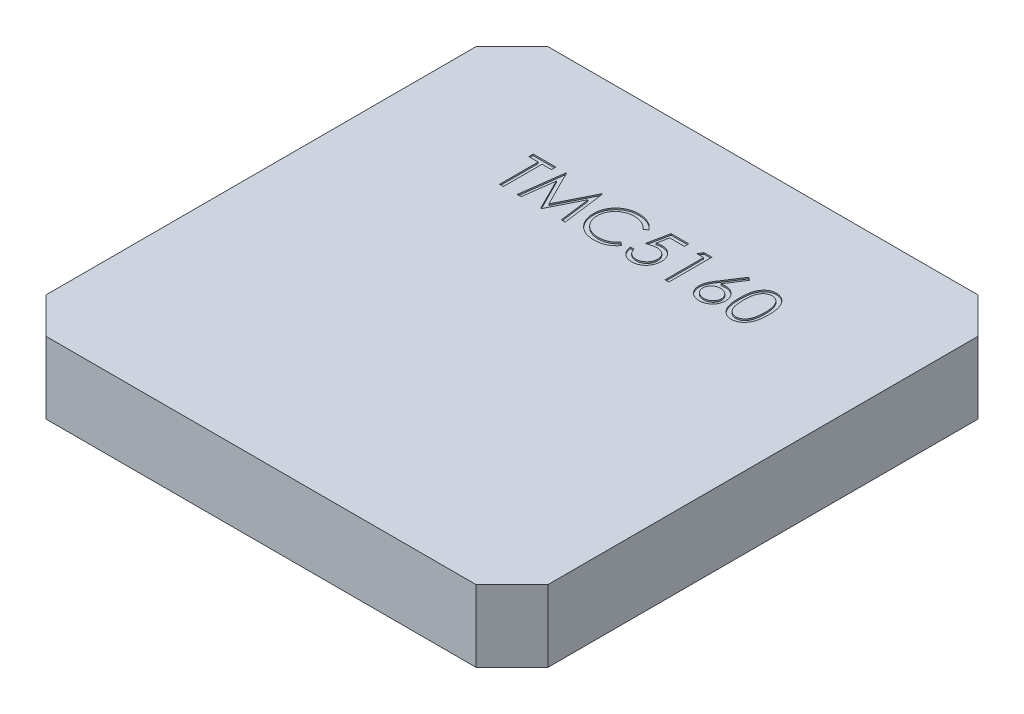
from build123d import *

# Parameters (mm, degrees)
BASES_W          = 7
BASES_H          = 7
BASE_DEPTH       = 1
PARTNUMBER_DEPTH = 0.02
PNC_SIZE         = 0.5


with BuildPart() as part:
    # BaseS → Base (new body)
    with BuildSketch(Plane(origin=(0, 0, 0), x_dir=(1, 0, 0), z_dir=(0, 1, 0))):
        Rectangle(BASES_W, BASES_H)
    extrude(amount=BASE_DEPTH)

    # PartNumberS → PartNumber (cut)
    # profile 1 of 7: a face of its own
    with BuildSketch(Plane(origin=(0, 1, 0), x_dir=(1, 0, 0), z_dir=(0, 1, 0))):
        with BuildLine():
            add(Edge.make_bspline(
                [(1.373076923, 1.799759615), (1.373133155, 1.80937631), (1.373242386, 1.828056879), (1.374457543, 1.855277104), (1.376476174, 1.880813153), (1.37924258, 1.90466625), (1.382609091, 1.926842553), (1.387103175, 1.947282797), (1.392213941, 1.966081586), (1.398137217, 1.983300223), (1.404820838, 1.999170687), (1.412095283, 2.013986435), (1.420249248, 2.027725052), (1.428816718, 2.040605816), (1.438144502, 2.052417878), (1.447967152, 2.063328049), (1.458668045, 2.073084178), (1.469883418, 2.081972115), (1.481714812, 2.089763453), (1.493824983, 2.096626209), (1.506297287, 2.102489043), (1.519165776, 2.107098832), (1.532314785, 2.110906406), (1.545790283, 2.113510225), (1.559614516, 2.115148552), (1.56894562, 2.115305181), (1.573677885, 2.115384615)],
                knots=[0, 0, 0, 0, 1.646270934, 3.197905019, 4.663502075, 6.030701355, 7.308322542, 8.50163776, 9.611534131, 10.641858119, 11.616356847, 12.558055219, 13.465016945, 14.349605745, 15.204443733, 16.039544428, 16.859896111, 17.680448484, 18.487036065, 19.28249412, 20.06191084, 20.843045899, 21.620316918, 22.403196591, 23.190181807, 24, 24, 24, 24], degree=3))
            add(Edge.make_bspline(
                [(1.573677885, 2.115384615), (1.578449681, 2.11530099), (1.587939282, 2.115134685), (1.601969061, 2.113536295), (1.615674721, 2.110884103), (1.62899783, 2.107126221), (1.642047828, 2.102464105), (1.654722641, 2.096620599), (1.667100998, 2.089818508), (1.67898619, 2.081825843), (1.690508695, 2.072914596), (1.701385489, 2.062840995), (1.711617561, 2.051706758), (1.721333327, 2.03963101), (1.730257144, 2.026382138), (1.738755447, 2.012190576), (1.746362081, 1.996808142), (1.753688026, 1.980491491), (1.760011509, 1.962789149), (1.765714294, 1.943800905), (1.770322117, 1.923302473), (1.774160278, 1.901401402), (1.777133689, 1.878017262), (1.779299285, 1.853200179), (1.780443242, 1.826933827), (1.780658677, 1.808975338), (1.780769231, 1.799759615)],
                knots=[0, 0, 0, 0, 0.810914788, 1.612654377, 2.396697861, 3.181598691, 3.963628158, 4.749916497, 5.551656086, 6.361998678, 7.18212741, 8.025565596, 8.878627764, 9.750805457, 10.657531673, 11.591944965, 12.560506719, 13.57287815, 14.630710178, 15.753379473, 16.941251878, 18.199788006, 19.531962791, 20.947069417, 22.433333509, 24, 24, 24, 24], degree=3))
            add(Edge.make_bspline(
                [(1.780769231, 1.799759615), (1.780657531, 1.790584088), (1.780439887, 1.772705948), (1.779312109, 1.746557781), (1.777090629, 1.721872402), (1.774311774, 1.698590608), (1.770463038, 1.676809302), (1.765730723, 1.656453111), (1.760476382, 1.637434127), (1.753990418, 1.61990816), (1.746891439, 1.603630722), (1.739167691, 1.588430639), (1.730892864, 1.57417356), (1.72187765, 1.560973604), (1.712268494, 1.548737262), (1.70185973, 1.537680527), (1.690944772, 1.527536983), (1.679388358, 1.51851099), (1.667317807, 1.510610738), (1.654981965, 1.503545506), (1.642161956, 1.497848473), (1.629148307, 1.492956752), (1.615754873, 1.489219531), (1.601998349, 1.486635442), (1.587948708, 1.484823125), (1.578451297, 1.484684871), (1.573677885, 1.484615385)],
                knots=[0, 0, 0, 0, 1.561518951, 3.042555995, 4.452378317, 5.7783523, 7.031515105, 8.214008947, 9.334062868, 10.386615937, 11.391082383, 12.354592575, 13.286541444, 14.194233754, 15.072674879, 15.931287219, 16.775624067, 17.606195743, 18.42308326, 19.229000347, 20.022332153, 20.807536673, 21.593273796, 22.3848459, 23.188221202, 24, 24, 24, 24], degree=3))
            add(Edge.make_bspline(
                [(1.573677885, 1.484615385), (1.568945751, 1.484695331), (1.559614907, 1.48485297), (1.545788776, 1.486483896), (1.532368929, 1.489105982), (1.519289143, 1.4927774), (1.506482311, 1.497271372), (1.494122948, 1.503126289), (1.482073631, 1.509869272), (1.470366507, 1.517548487), (1.459221565, 1.52634649), (1.44857609, 1.536077511), (1.438697515, 1.546984382), (1.429503099, 1.558894883), (1.420764684, 1.571699439), (1.412726505, 1.585572874), (1.405291502, 1.600460179), (1.398495475, 1.616457535), (1.39246999, 1.63379838), (1.387147525, 1.652681096), (1.382945098, 1.673272348), (1.37934802, 1.695406754), (1.376446698, 1.719179427), (1.374465956, 1.744603275), (1.373241731, 1.771662454), (1.373132861, 1.790222986), (1.373076923, 1.799759615)],
                knots=[0, 0, 0, 0, 0.810891512, 1.598919785, 2.382837074, 3.152667961, 3.926044502, 4.706494248, 5.493654104, 6.291793342, 7.103789334, 7.925228297, 8.761435821, 9.622817696, 10.50288917, 11.416980706, 12.369136599, 13.353924996, 14.394355917, 15.514179734, 16.714354668, 17.994756427, 19.357759367, 20.818452758, 22.365282078, 24, 24, 24, 24], degree=3))
        make_face()
        with BuildLine():
            add(Edge.make_bspline(
                [(1.426923077, 1.8), (1.426943554, 1.791985937), (1.426983295, 1.776432215), (1.428021501, 1.753830514), (1.429435826, 1.732749886), (1.431260048, 1.713163565), (1.433969125, 1.695137849), (1.437004575, 1.67854876), (1.440698533, 1.663484091), (1.445069107, 1.649840466), (1.450047238, 1.63738634), (1.455482529, 1.625797561), (1.46132151, 1.614937229), (1.467856222, 1.604902896), (1.47497309, 1.595661839), (1.482511363, 1.587050496), (1.490752377, 1.579371014), (1.502153019, 1.570160696), (1.517203843, 1.56064313), (1.53616735, 1.552355229), (1.55565337, 1.547146808), (1.568879298, 1.54648445), (1.575480769, 1.546153846)],
                knots=[0, 0, 0, 0, 1.459021318, 2.831673884, 4.118529203, 5.306027144, 6.411944654, 7.436330062, 8.375795394, 9.233974572, 10.042671642, 10.816086306, 11.563610507, 12.285937304, 12.993564865, 13.685989202, 14.367179055, 15.041617293, 16.353048772, 17.594441528, 18.799311195, 20, 20, 20, 20], degree=3))
            add(Edge.make_bspline(
                [(1.575480769, 1.546153846), (1.582124942, 1.546427751), (1.595399568, 1.546974996), (1.614793933, 1.55225478), (1.63362198, 1.560220987), (1.648377169, 1.569640559), (1.659602748, 1.57861113), (1.667645661, 1.586259355), (1.675027726, 1.594823218), (1.682029225, 1.604063098), (1.688450781, 1.614155523), (1.694290176, 1.625051965), (1.699618749, 1.636782681), (1.702654586, 1.644971779), (1.704206731, 1.649158654)],
                knots=[0, 0, 0, 0, 1.353760809, 2.704726607, 4.075137775, 5.516104923, 6.260822281, 7.007110065, 7.778089737, 8.566572457, 9.372053459, 10.217411131, 11.088608312, 12, 12, 12, 12], degree=3))
            add(Edge.make_bspline(
                [(1.704206731, 1.649158654), (1.706015605, 1.654512323), (1.709688396, 1.665382569), (1.714421843, 1.682244909), (1.718149626, 1.699936812), (1.721503346, 1.718352546), (1.723792441, 1.737627923), (1.725634923, 1.757703303), (1.726720184, 1.778593822), (1.726854713, 1.79278725), (1.726923077, 1.8)],
                knots=[0, 0, 0, 0, 0.884706709, 1.796334032, 2.740027952, 3.714592787, 4.726048262, 5.777819803, 6.87074269, 8, 8, 8, 8], degree=3))
            add(Edge.make_bspline(
                [(1.726923077, 1.8), (1.726828759, 1.807211584), (1.726644252, 1.821318984), (1.725938997, 1.841979243), (1.724117813, 1.861602288), (1.722095107, 1.880272655), (1.719112726, 1.897886992), (1.715897102, 1.914592759), (1.711576894, 1.930182992), (1.706962076, 1.944901777), (1.701680294, 1.958581889), (1.695866168, 1.97128711), (1.689656723, 1.983078777), (1.682912339, 1.993924538), (1.675713079, 2.003872974), (1.667868928, 2.012724619), (1.659691036, 2.020753814), (1.648236661, 2.029918825), (1.633241068, 2.039263687), (1.614581815, 2.047863532), (1.59516399, 2.052802096), (1.582037112, 2.053498386), (1.575480769, 2.053846154)],
                knots=[0, 0, 0, 0, 1.31362396, 2.569729283, 3.763502607, 4.902122613, 5.988968491, 7.01645872, 7.998833611, 8.933434873, 9.825090667, 10.667526885, 11.477055099, 12.250526234, 12.991942729, 13.710640831, 14.402115721, 15.076753259, 16.378508321, 17.609869233, 18.806226677, 20, 20, 20, 20], degree=3))
            add(Edge.make_bspline(
                [(1.575480769, 2.053846154), (1.568844668, 2.053497906), (1.555560375, 2.052800775), (1.535940726, 2.047881932), (1.517134266, 2.039308281), (1.502178327, 2.029887874), (1.490715964, 2.020915592), (1.482644645, 2.013135057), (1.47507673, 2.004624271), (1.468105124, 1.995298228), (1.461575533, 1.985275594), (1.455578788, 1.97447752), (1.450175817, 1.962849286), (1.445189896, 1.950400754), (1.44080599, 1.936758306), (1.437189882, 1.921712193), (1.433849244, 1.905175869), (1.431484341, 1.887052525), (1.429381983, 1.867461298), (1.428030894, 1.846328044), (1.426979822, 1.823688436), (1.426942371, 1.808054294), (1.426923077, 1.8)],
                knots=[0, 0, 0, 0, 1.207732386, 2.417664972, 3.655092373, 4.956220595, 5.625982001, 6.301752483, 6.994047911, 7.697131622, 8.419323945, 9.170223765, 9.943494443, 10.752040957, 11.610060368, 12.549350801, 13.567764191, 14.679664412, 15.874934091, 17.154273443, 18.533957287, 20, 20, 20, 20], degree=3))
        make_face(mode=Mode.SUBTRACT)
    # profile 2 of 7: a face of its own
    with BuildSketch(Plane(origin=(0, 1, 0), x_dir=(1, 0, 0), z_dir=(0, 1, 0))):
        with BuildLine():
            Line((1.188461538, 2.115384615), (1.229927885, 2.0828125))
            Line((1.229927885, 2.0828125), (1.071394231, 1.840384615))
            add(Edge.make_bspline(
                [(1.071394231, 1.840384615), (1.081949135, 1.842066991), (1.10253767, 1.845348656), (1.123377539, 1.845890018), (1.133533654, 1.846153846)],
                knots=[0, 0, 0, 0, 1.025318673, 2, 2, 2, 2], degree=3))
            add(Edge.make_bspline(
                [(1.133533654, 1.846153846), (1.139631796, 1.845989941), (1.151635808, 1.845667299), (1.169259831, 1.843184354), (1.186195077, 1.839271477), (1.202371353, 1.833567662), (1.217846722, 1.826281544), (1.23270999, 1.817549166), (1.246681763, 1.806919621), (1.259941965, 1.795045629), (1.271980896, 1.781894146), (1.282639648, 1.767939631), (1.291592813, 1.753196623), (1.298856913, 1.737672588), (1.30449775, 1.721391458), (1.308609917, 1.704374063), (1.311040705, 1.686608668), (1.311370789, 1.674526695), (1.311538462, 1.668389423)],
                knots=[0, 0, 0, 0, 1.04369286, 2.054478336, 3.041073146, 4.015093852, 4.984733326, 5.965804835, 6.960378782, 7.985147595, 9.009457201, 10.008161701, 10.986880575, 11.956520048, 12.937015923, 13.931873656, 14.949455224, 16, 16, 16, 16], degree=3))
            add(Edge.make_bspline(
                [(1.311538462, 1.668389423), (1.311294501, 1.659992902), (1.310814444, 1.643470537), (1.306030936, 1.619405959), (1.298597854, 1.596480384), (1.287973135, 1.575059841), (1.274776155, 1.555173686), (1.258682853, 1.537553321), (1.240263969, 1.521838457), (1.219437661, 1.508697322), (1.197024581, 1.497965371), (1.173478525, 1.490257043), (1.149028157, 1.485511306), (1.132433081, 1.484916345), (1.124038462, 1.484615385)],
                knots=[0, 0, 0, 0, 1.031375318, 2.029502543, 3.004789286, 3.987476834, 4.960371455, 5.9300674, 6.912260825, 7.929083631, 8.949397511, 9.960523116, 10.96833055, 12, 12, 12, 12], degree=3))
            add(Edge.make_bspline(
                [(1.124038462, 1.484615385), (1.115964741, 1.484877363), (1.099972115, 1.485396296), (1.076446494, 1.490019028), (1.053841405, 1.497511674), (1.032315225, 1.507834122), (1.012374549, 1.520872616), (0.994534725, 1.536569007), (0.978884707, 1.554587772), (0.965860486, 1.574926117), (0.955530418, 1.596781539), (0.947783574, 1.619570765), (0.943258503, 1.643210762), (0.942626179, 1.6592361), (0.942307692, 1.667307692)],
                knots=[0, 0, 0, 0, 1.012016664, 2.004627821, 2.994792927, 3.992885782, 4.990978636, 5.973936114, 6.964471063, 7.975201453, 8.993600317, 9.990122807, 10.98767138, 12, 12, 12, 12], degree=3))
            add(Edge.make_bspline(
                [(0.942307692, 1.667307692), (0.942510226, 1.673486764), (0.94292376, 1.686103247), (0.945811199, 1.705211366), (0.950450878, 1.72476298), (0.95564692, 1.741349413), (0.961137025, 1.754937103), (0.965706031, 1.765891987), (0.971393002, 1.777165314), (0.97745701, 1.789143651), (0.984443902, 1.801518297), (0.992040871, 1.814496069), (1.000457954, 1.827870571), (1.006358553, 1.836946718), (1.009375, 1.841586538)],
                knots=[0, 0, 0, 0, 1.173818275, 2.396712641, 3.66331629, 4.989737886, 5.693666774, 6.447286557, 7.243889047, 8.091586357, 8.998013824, 9.943181721, 10.948533338, 12, 12, 12, 12], degree=3))
            Line((1.009375, 1.841586538), (1.188461538, 2.115384615))
        make_face()
        with BuildLine():
            add(Edge.make_bspline(
                [(1.122235577, 1.784615385), (1.117664906, 1.784482006), (1.108737059, 1.784221478), (1.095638645, 1.782708578), (1.083242088, 1.779859595), (1.071383151, 1.776231081), (1.060283544, 1.771241985), (1.0498626, 1.765181677), (1.04008002, 1.758046617), (1.031038268, 1.74993789), (1.022840612, 1.741059941), (1.015780989, 1.73155088), (1.009691435, 1.721639874), (1.004740266, 1.711244113), (1.000884824, 1.70036757), (0.998095981, 1.68906027), (0.99654391, 1.677246389), (0.996285699, 1.669235103), (0.996153846, 1.665144231)],
                knots=[0, 0, 0, 0, 1.129588631, 2.206414736, 3.251139165, 4.268635594, 5.265702196, 6.250456724, 7.242448911, 8.251968645, 9.246821453, 10.222880186, 11.173611482, 12.116736599, 13.062300278, 14.020270554, 14.989073742, 16, 16, 16, 16], degree=3))
            add(Edge.make_bspline(
                [(0.996153846, 1.665144231), (0.996261222, 1.661089949), (0.996471771, 1.653140105), (0.998383598, 1.641424817), (1.001303897, 1.630150832), (1.005647965, 1.619376273), (1.010829717, 1.608936904), (1.01767063, 1.599210855), (1.025250651, 1.589607414), (1.034311325, 1.580864305), (1.04403533, 1.572728884), (1.054424108, 1.565617983), (1.065251529, 1.559534639), (1.076663773, 1.554767022), (1.088498925, 1.550854287), (1.100855591, 1.548100891), (1.113742366, 1.546544229), (1.122471841, 1.546285682), (1.126923077, 1.546153846)],
                knots=[0, 0, 0, 0, 0.989467248, 1.94019797, 2.891935182, 3.827694429, 4.772920941, 5.730924762, 6.725747692, 7.756678648, 8.79901574, 9.819492441, 10.826891316, 11.826466727, 12.835195252, 13.867842842, 14.912794438, 16, 16, 16, 16], degree=3))
            add(Edge.make_bspline(
                [(1.126923077, 1.546153846), (1.131374305, 1.546285692), (1.140103766, 1.54654426), (1.152990645, 1.548100775), (1.165346928, 1.550854714), (1.177183472, 1.554765475), (1.188590575, 1.559540379), (1.199408527, 1.565580137), (1.209699057, 1.572772614), (1.219429446, 1.580850402), (1.228452407, 1.589657177), (1.236214226, 1.599125129), (1.242845637, 1.609015511), (1.248234355, 1.619335149), (1.252530577, 1.630157347), (1.255465685, 1.641423071), (1.257373563, 1.653140561), (1.257584655, 1.661090103), (1.257692308, 1.665144231)],
                knots=[0, 0, 0, 0, 1.087397944, 2.132534446, 3.165364764, 4.174271784, 5.174024072, 6.181601208, 7.194203697, 8.236725232, 9.267838612, 10.269026844, 11.221737037, 12.171628256, 13.107553087, 14.05945871, 15.010357665, 16, 16, 16, 16], degree=3))
            add(Edge.make_bspline(
                [(1.257692308, 1.665144231), (1.257597972, 1.669240439), (1.257412821, 1.677279965), (1.255318658, 1.689054985), (1.252414251, 1.700425021), (1.248028589, 1.711318612), (1.242330896, 1.721692771), (1.235390883, 1.731599902), (1.227362442, 1.741115962), (1.218088578, 1.749955301), (1.20799311, 1.758037657), (1.197259009, 1.765172438), (1.186029071, 1.771193863), (1.174314681, 1.776217937), (1.161981615, 1.779843561), (1.149228986, 1.782698403), (1.135893687, 1.784217606), (1.126846268, 1.784481103), (1.122235577, 1.784615385)],
                knots=[0, 0, 0, 0, 0.978206639, 1.919901502, 2.851605144, 3.780102724, 4.718870031, 5.675451981, 6.667674623, 7.690630536, 8.733308323, 9.756129687, 10.767539656, 11.776269907, 12.797430371, 13.836405707, 14.897401972, 16, 16, 16, 16], degree=3))
        make_face(mode=Mode.SUBTRACT)
    # profile 3 of 7: a face of its own
    with BuildSketch(Plane(origin=(0, 1, 0), x_dir=(1, 0, 0), z_dir=(0, 1, 0))):
        Polygon((0.577524038, 2.1), (0.688461538, 2.1), (0.688461538, 1.5), (0.634615385, 1.5), (0.634615385, 2.038461538), (0.542307692, 2.038461538), align=None)
    # profile 4 of 7: a face of its own
    with BuildSketch(Plane(origin=(0, 1, 0), x_dir=(1, 0, 0), z_dir=(0, 1, 0))):
        with BuildLine():
            Line((0.365384615, 2.1), (0.365384615, 2.038461538))
            Line((0.365384615, 2.038461538), (0.161298077, 2.038461538))
            Line((0.161298077, 2.038461538), (0.128966346, 1.880649038))
            add(Edge.make_bspline(
                [(0.128966346, 1.880649038), (0.135318782, 1.882402799), (0.147625621, 1.885800434), (0.165790169, 1.889572851), (0.183034546, 1.891846928), (0.19422461, 1.892157438), (0.199639423, 1.892307692)],
                knots=[0, 0, 0, 0, 1.100273476, 2.13160584, 3.095893838, 4, 4, 4, 4], degree=3))
            add(Edge.make_bspline(
                [(0.199639423, 1.892307692), (0.206339493, 1.892162675), (0.219513504, 1.891877534), (0.238788752, 1.889139503), (0.257188676, 1.884829803), (0.274674797, 1.878809142), (0.291279463, 1.871110331), (0.306849902, 1.861493198), (0.32161983, 1.850258913), (0.335324274, 1.837342625), (0.347757013, 1.823127491), (0.358688326, 1.807843284), (0.367973341, 1.791638542), (0.375440899, 1.774358438), (0.381403928, 1.756194012), (0.385372841, 1.73695414), (0.388015706, 1.716820177), (0.388310972, 1.703053679), (0.388461538, 1.696033654)],
                knots=[0, 0, 0, 0, 1.052922333, 2.070308379, 3.05430497, 4.020497103, 4.973039431, 5.925935799, 6.892292201, 7.88610001, 8.88166317, 9.857072816, 10.836096531, 11.812156883, 12.81219415, 13.836441305, 14.89672472, 16, 16, 16, 16], degree=3))
            add(Edge.make_bspline(
                [(0.388461538, 1.696033654), (0.388347526, 1.69114413), (0.388121041, 1.681431161), (0.386969283, 1.667006441), (0.384751731, 1.652887098), (0.381774407, 1.63907126), (0.377909993, 1.625585081), (0.373231869, 1.612389962), (0.367506836, 1.59956803), (0.361227172, 1.586997962), (0.354156347, 1.574963932), (0.346308603, 1.56370982), (0.338017376, 1.553066801), (0.329095995, 1.543149018), (0.319461539, 1.534021643), (0.309230687, 1.525630509), (0.298485078, 1.51783371), (0.287058465, 1.510947734), (0.275205468, 1.504611227), (0.262754917, 1.499412906), (0.249990225, 1.494765387), (0.236727675, 1.491060897), (0.222997307, 1.488158173), (0.208776489, 1.486186641), (0.194139802, 1.484750681), (0.184218372, 1.484660791), (0.179206731, 1.484615385)],
                knots=[0, 0, 0, 0, 1.056347294, 2.098418968, 3.122841568, 4.141288669, 5.149314143, 6.15115421, 7.162517403, 8.180376062, 9.185164535, 10.17417709, 11.141909838, 12.097768115, 13.052685741, 14.0056014, 14.954263652, 15.917497458, 16.885230207, 17.854509472, 18.828990115, 19.81800267, 20.826176721, 21.857883937, 22.917946725, 24, 24, 24, 24], degree=3))
            add(Edge.make_bspline(
                [(0.179206731, 1.484615385), (0.1732283, 1.484733814), (0.161466443, 1.48496681), (0.144234346, 1.487404264), (0.127654699, 1.490895221), (0.111860968, 1.496147153), (0.096711608, 1.502727833), (0.082410571, 1.511044891), (0.068592438, 1.52046988), (0.055818946, 1.531592226), (0.043963612, 1.5437492), (0.033351068, 1.556941939), (0.023899597, 1.5709527), (0.015760555, 1.585849526), (0.008818037, 1.601593275), (0.003364039, 1.618242932), (-0.001037965, 1.635711504), (-0.002900265, 1.64773782), (-0.003846154, 1.653846154)],
                knots=[0, 0, 0, 0, 1.0467383, 2.05933395, 3.04377827, 4.011590433, 4.970194871, 5.932262533, 6.905835911, 7.896367577, 8.894135286, 9.877477877, 10.858688626, 11.851381753, 12.8477658, 13.868841284, 14.917554742, 16, 16, 16, 16], degree=3))
            Line((-0.003846154, 1.653846154), (0.05, 1.653846154))
            add(Edge.make_bspline(
                [(0.05, 1.653846154), (0.051324896, 1.648124476), (0.053871418, 1.637127094), (0.059460975, 1.621676007), (0.066295125, 1.607906997), (0.074421585, 1.595637926), (0.084115876, 1.584939241), (0.095178064, 1.575404887), (0.107580531, 1.566803437), (0.121362227, 1.559633819), (0.135901612, 1.553519176), (0.151118848, 1.549447457), (0.166599593, 1.546584447), (0.177070171, 1.546297859), (0.182331731, 1.546153846)],
                knots=[0, 0, 0, 0, 1.136247022, 2.183929868, 3.172523383, 4.106158343, 5.02341133, 5.958108904, 6.928429099, 7.938127109, 8.96079061, 9.975095812, 10.982467395, 12, 12, 12, 12], degree=3))
            add(Edge.make_bspline(
                [(0.182331731, 1.546153846), (0.187467464, 1.546294551), (0.197579765, 1.5465716), (0.212461717, 1.548704002), (0.226829638, 1.551988157), (0.240541757, 1.556902989), (0.253838021, 1.56287637), (0.266382096, 1.570541811), (0.278536874, 1.579363529), (0.289924554, 1.589470379), (0.300354174, 1.600608041), (0.309569509, 1.612518452), (0.317245552, 1.625224197), (0.323714256, 1.638505309), (0.32862625, 1.652507347), (0.332130418, 1.667164691), (0.334188086, 1.682513545), (0.334471145, 1.69298257), (0.334615385, 1.698317308)],
                knots=[0, 0, 0, 0, 1.027316725, 2.022795036, 3.002884548, 3.971462791, 4.93288096, 5.914575861, 6.907176829, 7.935150275, 8.956128384, 9.956726525, 10.942570165, 11.921478529, 12.907843606, 13.90538589, 14.932640048, 16, 16, 16, 16], degree=3))
            add(Edge.make_bspline(
                [(0.334615385, 1.698317308), (0.334502502, 1.703130294), (0.334281552, 1.712551029), (0.332476311, 1.72633375), (0.329336259, 1.739374843), (0.324977879, 1.751737283), (0.319444249, 1.76343273), (0.312682024, 1.774473255), (0.304564299, 1.784713341), (0.295291404, 1.794157778), (0.285132882, 1.802874043), (0.273913955, 1.810304458), (0.261869396, 1.816555415), (0.249144322, 1.821949929), (0.235436054, 1.825824342), (0.22101606, 1.828733123), (0.205728624, 1.830415756), (0.195276506, 1.830649223), (0.189903846, 1.830769231)],
                knots=[0, 0, 0, 0, 1.045622112, 2.046656509, 3.013763289, 3.955457236, 4.890082067, 5.820317437, 6.762574623, 7.722996705, 8.69280354, 9.665887285, 10.63943826, 11.638615906, 12.663482002, 13.728887084, 14.832589034, 16, 16, 16, 16], degree=3))
            add(Edge.make_bspline(
                [(0.189903846, 1.830769231), (0.185253173, 1.830669701), (0.175650712, 1.830464197), (0.160921084, 1.828951083), (0.145442503, 1.826510061), (0.129274304, 1.823152419), (0.112367931, 1.81875852), (0.094759062, 1.813493177), (0.076410674, 1.807197977), (0.064047635, 1.802443883), (0.057692308, 1.8)],
                knots=[0, 0, 0, 0, 0.817624296, 1.688186739, 2.600797293, 3.572016777, 4.590301741, 5.671205678, 6.80286297, 8, 8, 8, 8], degree=3))
            Line((0.057692308, 1.8), (0.119230769, 2.1))
            Line((0.119230769, 2.1), (0.365384615, 2.1))
        make_face()
    # profile 5 of 7: a face of its own
    with BuildSketch(Plane(origin=(0, 1, 0), x_dir=(1, 0, 0), z_dir=(0, 1, 0))):
        with BuildLine():
            Line((-0.080769231, 1.989903846), (-0.127884615, 1.953846154))
            add(Edge.make_bspline(
                [(-0.127884615, 1.953846154), (-0.131245625, 1.957851749), (-0.13792233, 1.965808934), (-0.148663908, 1.97698257), (-0.159858475, 1.987450901), (-0.171501753, 1.997263795), (-0.183803316, 2.006078097), (-0.196465167, 2.014353144), (-0.209699118, 2.02177047), (-0.227999415, 2.030764125), (-0.251939046, 2.04014918), (-0.282075305, 2.048018305), (-0.31353435, 2.05302765), (-0.334996796, 2.053570194), (-0.345913462, 2.053846154)],
                knots=[0, 0, 0, 0, 0.757959112, 1.505699292, 2.245454638, 2.979532153, 3.711538275, 4.438200793, 5.171680507, 5.909471876, 7.393775596, 8.890124382, 10.418191784, 12, 12, 12, 12], degree=3))
            add(Edge.make_bspline(
                [(-0.345913462, 2.053846154), (-0.351927741, 2.053776903), (-0.363900483, 2.053639044), (-0.381668793, 2.051820337), (-0.399105316, 2.04926413), (-0.41619871, 2.045471217), (-0.432927217, 2.040675911), (-0.4494002, 2.03494584), (-0.46537916, 2.027856439), (-0.481085144, 2.020020737), (-0.496133009, 2.011170318), (-0.510371017, 2.001516601), (-0.52374724, 1.991167613), (-0.536272259, 1.980084566), (-0.547958879, 1.968317373), (-0.558722418, 1.955740629), (-0.568525631, 1.942394542), (-0.577562835, 1.9284551), (-0.585656447, 1.913962907), (-0.592432998, 1.898864324), (-0.598433876, 1.883417906), (-0.603182317, 1.867449136), (-0.606940806, 1.851070376), (-0.60953412, 1.83423767), (-0.611332143, 1.816986182), (-0.611469316, 1.805293157), (-0.611538462, 1.799399038)],
                knots=[0, 0, 0, 0, 1.054917814, 2.100044995, 3.131103042, 4.146048494, 5.169673617, 6.183595914, 7.203665975, 8.234915748, 9.262203917, 10.264457458, 11.251630812, 12.227803204, 13.197192746, 14.159520551, 15.12972552, 16.100847026, 17.073214652, 18.039054194, 19.002613845, 19.979014051, 20.95965708, 21.949030935, 22.966165397, 24, 24, 24, 24], degree=3))
            add(Edge.make_bspline(
                [(-0.611538462, 1.799399038), (-0.61132215, 1.790530812), (-0.61089745, 1.773119226), (-0.607117736, 1.747615693), (-0.601374006, 1.723183577), (-0.592765621, 1.699975605), (-0.582150927, 1.6777056), (-0.568738251, 1.656750368), (-0.553203987, 1.636793243), (-0.535328372, 1.61830588), (-0.515715947, 1.601417813), (-0.494673447, 1.586546285), (-0.472253284, 1.574149448), (-0.448703004, 1.563833571), (-0.423841385, 1.555903847), (-0.397713133, 1.550321426), (-0.370375077, 1.546679909), (-0.351694608, 1.546331277), (-0.3421875, 1.546153846)],
                knots=[0, 0, 0, 0, 1.029171465, 2.020641659, 2.987623507, 3.938342917, 4.889210282, 5.84687017, 6.821220943, 7.821438502, 8.827599549, 9.822697543, 10.807740252, 11.797342354, 12.80366471, 13.83203677, 14.896651826, 16, 16, 16, 16], degree=3))
            add(Edge.make_bspline(
                [(-0.3421875, 1.546153846), (-0.331712753, 1.546443351), (-0.311095946, 1.547013167), (-0.280861427, 1.551840466), (-0.251918153, 1.559667538), (-0.224264567, 1.570621468), (-0.197978628, 1.584861231), (-0.1730192, 1.602123724), (-0.149365217, 1.622573153), (-0.135141568, 1.638187404), (-0.127884615, 1.646153846)],
                knots=[0, 0, 0, 0, 1.028121516, 2.023589091, 2.998037872, 3.967518031, 4.937445131, 5.927275754, 6.942489185, 8, 8, 8, 8], degree=3))
            Line((-0.127884615, 1.646153846), (-0.080769231, 1.610456731))
            add(Edge.make_bspline(
                [(-0.080769231, 1.610456731), (-0.084560907, 1.605564425), (-0.092126097, 1.595803247), (-0.104376043, 1.582042382), (-0.117280722, 1.569098833), (-0.130935987, 1.557076955), (-0.145184751, 1.54573619), (-0.160282862, 1.535398733), (-0.176031839, 1.525920295), (-0.192378321, 1.517241394), (-0.20930494, 1.509541295), (-0.226791415, 1.50294922), (-0.24476237, 1.497270668), (-0.263218629, 1.492598907), (-0.282198473, 1.488952436), (-0.301633411, 1.486514777), (-0.32156539, 1.484844735), (-0.335012491, 1.48469252), (-0.341826923, 1.484615385)],
                knots=[0, 0, 0, 0, 0.986787822, 1.968848986, 2.935600012, 3.899624008, 4.868462664, 5.837806735, 6.815139263, 7.798259679, 8.787526145, 9.778297419, 10.776456485, 11.791383307, 12.812564526, 13.85620153, 14.913611965, 16, 16, 16, 16], degree=3))
            add(Edge.make_bspline(
                [(-0.341826923, 1.484615385), (-0.348280123, 1.484660298), (-0.361040527, 1.484749108), (-0.379880313, 1.486187765), (-0.398221384, 1.488150577), (-0.41601132, 1.491106028), (-0.433347201, 1.494593629), (-0.450071873, 1.499268702), (-0.466349909, 1.504505702), (-0.48211591, 1.510660842), (-0.497383288, 1.517606473), (-0.512102798, 1.525456455), (-0.526267672, 1.534144775), (-0.540017173, 1.543479919), (-0.553148187, 1.553761742), (-0.565774506, 1.564847451), (-0.57796693, 1.576699682), (-0.585510248, 1.585246228), (-0.589302885, 1.589543269)],
                knots=[0, 0, 0, 0, 1.114604814, 2.203992996, 3.262667896, 4.300477797, 5.318619304, 6.316056647, 7.298880507, 8.271930387, 9.238335007, 10.195173496, 11.151986948, 12.108099108, 13.064862484, 14.031167946, 15.010108607, 16, 16, 16, 16], degree=3))
            add(Edge.make_bspline(
                [(-0.589302885, 1.589543269), (-0.595377566, 1.597007473), (-0.607453591, 1.611845766), (-0.622903708, 1.635894792), (-0.636129003, 1.661003627), (-0.646822018, 1.687304187), (-0.655181344, 1.714737453), (-0.660972406, 1.743317255), (-0.664735538, 1.773016903), (-0.665165873, 1.793217495), (-0.665384615, 1.803485577)],
                knots=[0, 0, 0, 0, 0.994628077, 1.977248131, 2.950237994, 3.925870899, 4.908910175, 5.911660606, 6.938484602, 8, 8, 8, 8], degree=3))
            add(Edge.make_bspline(
                [(-0.665384615, 1.803485577), (-0.665118011, 1.81427794), (-0.664593483, 1.835511242), (-0.660137061, 1.866672491), (-0.652968124, 1.896527016), (-0.642785801, 1.925019087), (-0.629876312, 1.952298564), (-0.613928892, 1.978157056), (-0.595128811, 2.002759936), (-0.573623513, 2.025733893), (-0.550040542, 2.046740639), (-0.524785888, 2.065221703), (-0.497908983, 2.080601848), (-0.469705922, 2.093458333), (-0.43996552, 2.103340241), (-0.408751228, 2.11025793), (-0.3761217, 2.114563722), (-0.35385957, 2.115108043), (-0.342548077, 2.115384615)],
                knots=[0, 0, 0, 0, 1.032925535, 2.032216505, 3.007276963, 3.968222605, 4.92396291, 5.891752235, 6.871517503, 7.883894988, 8.900124299, 9.891468569, 10.874487609, 11.85992873, 12.854644235, 13.869047385, 14.917252991, 16, 16, 16, 16], degree=3))
            add(Edge.make_bspline(
                [(-0.342548077, 2.115384615), (-0.335654167, 2.115301963), (-0.322008368, 2.115138361), (-0.301822199, 2.113543023), (-0.282169229, 2.110883547), (-0.263035917, 2.10726365), (-0.244329183, 2.102770966), (-0.226191999, 2.096918343), (-0.208517938, 2.090226367), (-0.191418468, 2.082519201), (-0.174975631, 2.07386776), (-0.159194548, 2.064367938), (-0.144200572, 2.054031515), (-0.129888198, 2.042946399), (-0.116496848, 2.030878074), (-0.103646309, 2.018158486), (-0.091772981, 2.004421259), (-0.084443862, 1.994751842), (-0.080769231, 1.989903846)],
                knots=[0, 0, 0, 0, 1.096760587, 2.17092713, 3.219439832, 4.250915756, 5.268269357, 6.278326846, 7.281116186, 8.274029601, 9.260640565, 10.235837813, 11.203064059, 12.156899882, 13.114053108, 14.069676657, 15.032185724, 16, 16, 16, 16], degree=3))
        make_face()
    # profile 6 of 7: a face of its own
    with BuildSketch(Plane(origin=(0, 1, 0), x_dir=(1, 0, 0), z_dir=(0, 1, 0))):
        Polygon((-1.426923077, 1.5), (-1.347716346, 2.1), (-1.340024038, 2.1), (-1.092307692, 1.607692308), (-0.845192308, 2.1), (-0.837379808, 2.1), (-0.757692308, 1.5), (-0.811778846, 1.5), (-0.869230769, 1.931730769), (-1.085817308, 1.5), (-1.097956731, 1.5), (-1.315384615, 1.932692308), (-1.372716346, 1.5), align=None)
    # profile 7 of 7: a face of its own
    with BuildSketch(Plane(origin=(0, 1, 0), x_dir=(1, 0, 0), z_dir=(0, 1, 0))):
        Polygon((-1.803846154, 2.038461538), (-1.803846154, 2.1), (-1.488461538, 2.1), (-1.488461538, 2.038461538), (-1.619230769, 2.038461538), (-1.619230769, 1.5), (-1.673076923, 1.5), (-1.673076923, 2.038461538), align=None)
    extrude(amount=-PARTNUMBER_DEPTH, mode=Mode.SUBTRACT)

    # PNC
    pnc_edges = [part.edges().sort_by_distance(p)[0] for p in [
        (3.5, 0.5, 3.5),
        (-3.5, 0.5, 3.5),
        (-3.5, 0.5, -3.5),
        (3.5, 0.5, -3.5),
    ]]
    chamfer(pnc_edges, length=PNC_SIZE)


solid = part.part
